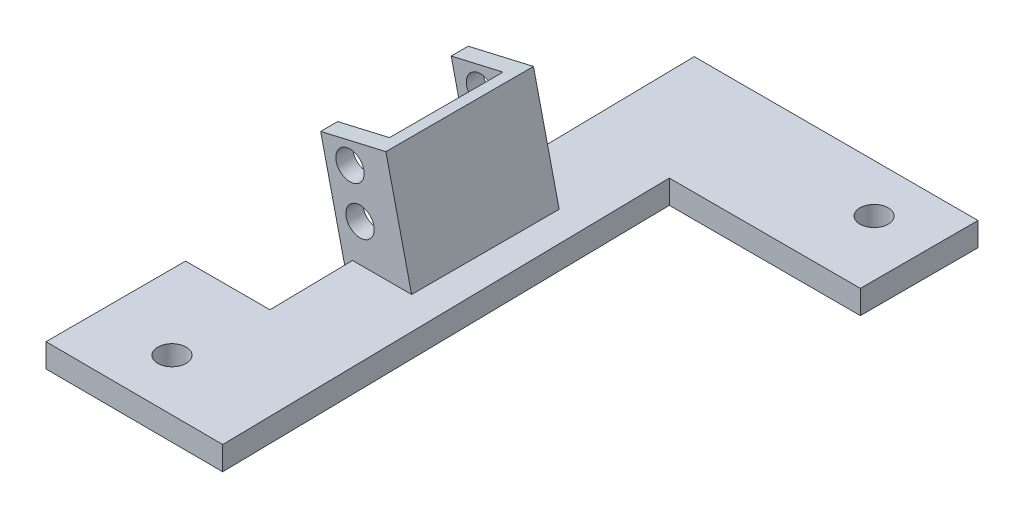
from build123d import *

# Parameters (mm, degrees)
BOSS_EXTRUDE1_DEPTH = 29.21
BOSS_EXTRUDE2_START = -3.81
SKETCH2_R           = 3.175
BOSS_EXTRUDE2_DEPTH = 3.81
BOSS_EXTRUDE3_START = 3.81
SKETCH3_R           = 3.175
BOSS_EXTRUDE3_DEPTH = 3.81
SKETCH5_R           = 3.175
BOSS_EXTRUDE4_DEPTH = 5.2893214


with BuildPart() as part:
    # Sketch1 → Boss-Extrude1 (new body)
    with BuildSketch(Plane.XY):
        with BuildLine():
            Line((357.71784023, 212.881801123), (352.217914789, 211.608277369))
            Line((352.217914789, 211.608277369), (352.938839753, 208.494842277))
            Line((352.938839753, 208.494842277), (367.542855209, 211.876444589))
            Line((367.542855209, 211.876444589), (361.796858989, 236.691490786))
            Line((361.796858989, 236.691490786), (358.789055407, 235.995025106))
            ThreePointArc((358.789055407, 235.995025106), (361.092162023, 232.728335773), (361.482600287, 228.750507566))
            ThreePointArc((361.482600287, 228.750507566), (361.532171417, 226.454028373), (362.395514522, 224.325434315))
            ThreePointArc((362.395514522, 224.325434315), (363.554671569, 220.88901177), (362.982664296, 217.307747657))
            ThreePointArc((362.982664296, 217.307747657), (360.881852793, 214.462416261), (357.71784023, 212.881801123))
        make_face()
    extrude(amount=-BOSS_EXTRUDE1_DEPTH)

    # Sketch2 → Boss-Extrude2 (add)
    with BuildSketch(Plane(origin=(0, 0, -29.21), x_dir=(-1, 0, 0), z_dir=(0, 0, -1)).offset(BOSS_EXTRUDE2_START)):
        with BuildLine():
            Line((-347.192843533, 233.309888473), (-352.217914789, 211.608277369))
            Line((-352.217914789, 211.608277369), (-357.71784023, 212.881801123))
            ThreePointArc((-357.71784023, 212.881801123), (-363.018157919, 217.393089456), (-362.395514522, 224.325434315))
            ThreePointArc((-362.395514522, 224.325434315), (-361.532171417, 226.454028373), (-361.482600287, 228.750507566))
            ThreePointArc((-361.482600287, 228.750507566), (-361.092162023, 232.728335773), (-358.789055407, 235.995025106))
            Line((-358.789055407, 235.995025106), (-347.192843533, 233.309888473))
        make_face()
        with Locations((-356.009914651, 220.257763535)):
            Circle(SKETCH2_R, mode=Mode.SUBTRACT)
        with Locations((-353.754071424, 230)):
            Circle(SKETCH2_R, mode=Mode.SUBTRACT)
    extrude(amount=BOSS_EXTRUDE2_DEPTH)

    # Sketch3 → Boss-Extrude3 (add)
    # profile 1 of 2: a face of its own
    with BuildSketch(Plane.XY.offset(BOSS_EXTRUDE3_START)):
        with BuildLine():
            Line((358.789055407, 235.995025106), (347.192843533, 233.309888473))
            Line((347.192843533, 233.309888473), (352.217914789, 211.608277369))
            Line((352.217914789, 211.608277369), (357.71784023, 212.881801123))
            ThreePointArc((357.71784023, 212.881801123), (363.018157919, 217.393089456), (362.395514522, 224.325434315))
            ThreePointArc((362.395514522, 224.325434315), (361.532171417, 226.454028373), (361.482600287, 228.750507566))
            ThreePointArc((361.482600287, 228.750507566), (361.092162023, 232.728335773), (358.789055407, 235.995025106))
        make_face()
        with Locations(Location((356.009914651, 220.257763535, 0), (0, 0, 180))):
            Circle(SKETCH3_R, mode=Mode.SUBTRACT)
        with Locations(Location((353.754071424, 230, 0), (0, 0, 180))):
            Circle(SKETCH3_R, mode=Mode.SUBTRACT)
    # profile 2 of 2: a face of its own
    with BuildSketch(Plane.XY.offset(BOSS_EXTRUDE3_START)):
        with BuildLine():
            ThreePointArc((361.482600287, 228.750507566), (361.532171417, 226.454028373), (362.395514522, 224.325434315))
            ThreePointArc((362.395514522, 224.325434315), (363.018157919, 217.393089456), (357.71784023, 212.881801123))
            Line((357.71784023, 212.881801123), (352.217914789, 211.608277369))
            Line((352.217914789, 211.608277369), (352.938839753, 208.494842277))
            Line((352.938839753, 208.494842277), (367.542855209, 211.876444589))
            Line((367.542855209, 211.876444589), (361.796858989, 236.691490786))
            Line((361.796858989, 236.691490786), (358.789055407, 235.995025106))
            ThreePointArc((358.789055407, 235.995025106), (361.092162023, 232.728335773), (361.482600287, 228.750507566))
        make_face()
    extrude(amount=-BOSS_EXTRUDE3_DEPTH)

    # Sketch5 → Boss-Extrude4 (add)
    with BuildSketch(Plane(origin=(0, 211.876444589, 0), x_dir=(1, 0, 0), z_dir=(0, 1, 0))):
        Polygon((353.064855209, 73.907779308), (416.564855209, 73.907779308), (416.564855209, 47.589788729), (373.814351909, 47.589788729), (375.477626365, -54.010211271), (335.779852437, -53.851377651), (335.779852437, -22.612220692), (354.644965943, -22.612220692), align=None)
        with Locations(Location((404.073297936, 63.14930327, 0), (0, 0, 270))):
            Circle(SKETCH5_R, mode=Mode.SUBTRACT)
        with Locations(Location((352.49755845, -42.393532045, 0), (0, 0, 270))):
            Circle(SKETCH5_R, mode=Mode.SUBTRACT)
    extrude(amount=-BOSS_EXTRUDE4_DEPTH)


solid = part.part
